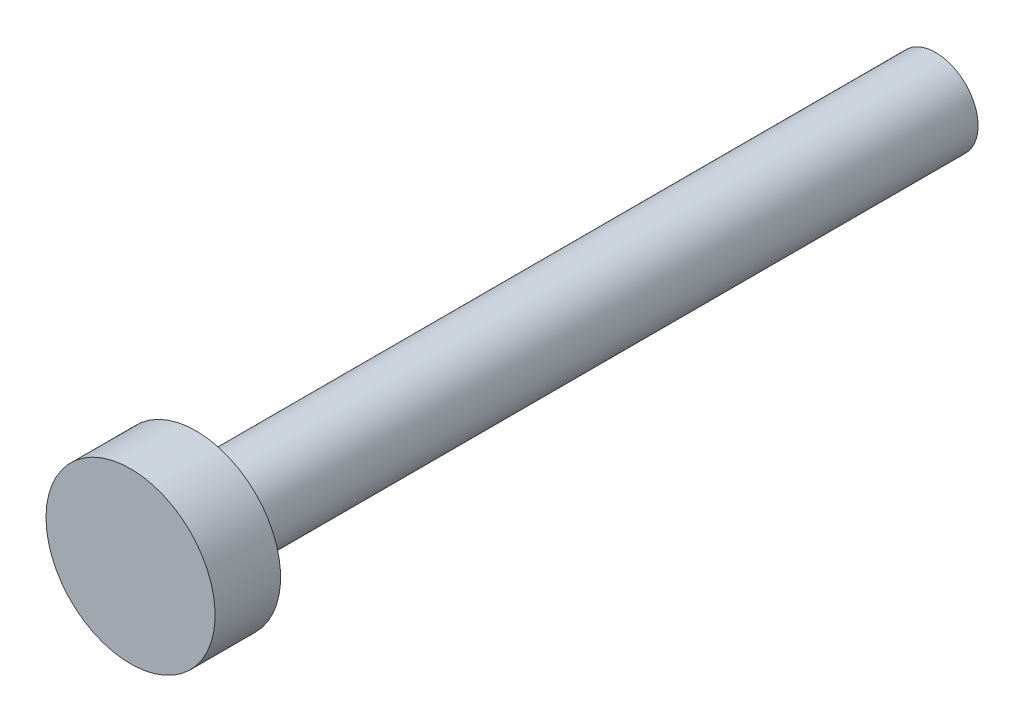
from build123d import *

# Parameters (mm, degrees)
ESQUISSE1_R        = 4
BOSS_EXTRU_1_DEPTH = 3.1
ESQUISSE2_R        = 2
BOSS_EXTRU_2_DEPTH = 35


with BuildPart() as part:
    # Esquisse1 → Boss.-Extru.1 (new body)
    with BuildSketch(Plane.XY):
        with Locations(Location((0, 0, 0), (0, 0, 180))):
            Circle(ESQUISSE1_R)
    extrude(amount=BOSS_EXTRU_1_DEPTH)

    # Esquisse2 → Boss.-Extru.2 (add)
    with BuildSketch(Plane(origin=(0, 0, 0), x_dir=(-1, 0, 0), z_dir=(0, 0, -1))):
        Circle(ESQUISSE2_R)
    extrude(amount=BOSS_EXTRU_2_DEPTH)


solid = part.part
